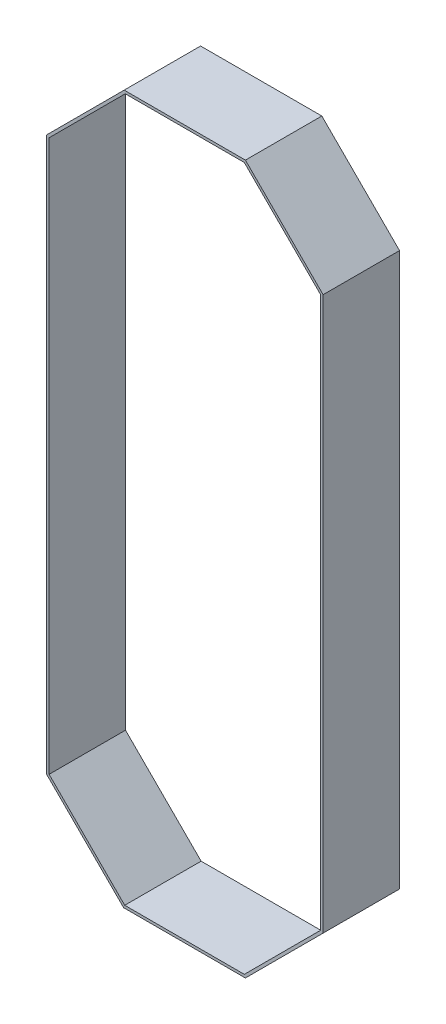
from build123d import *

# Parameters (mm, degrees)
EXTRUDE_1_DEPTH = 57.999999943


with BuildPart() as part:
    # Эскиз1 → Вытянуть-Тонкостенный1 (new body)
    with BuildSketch(Plane.XY):
        Polygon((105.164634146, 581.921622857), (46.181514364, 640.904742639), (-45.852246073, 640.904742639), (-104.835365854, 581.921622857), (-104.835365854, 161.778991183), (-46.267386785, 103.211012114), (46.172855331, 103.211012114), (105.164634146, 162.202790929), align=None)
        Polygon((103.164634146, 581.093195732), (45.35308724, 638.904742639), (-45.023818948, 638.904742639), (-102.835365854, 581.093195732), (-102.835365854, 162.607418308), (-45.438959661, 105.211012114), (45.344428206, 105.211012114), (103.164634146, 163.031218054), align=None, mode=Mode.SUBTRACT)
    extrude(amount=EXTRUDE_1_DEPTH)


solid = part.part
